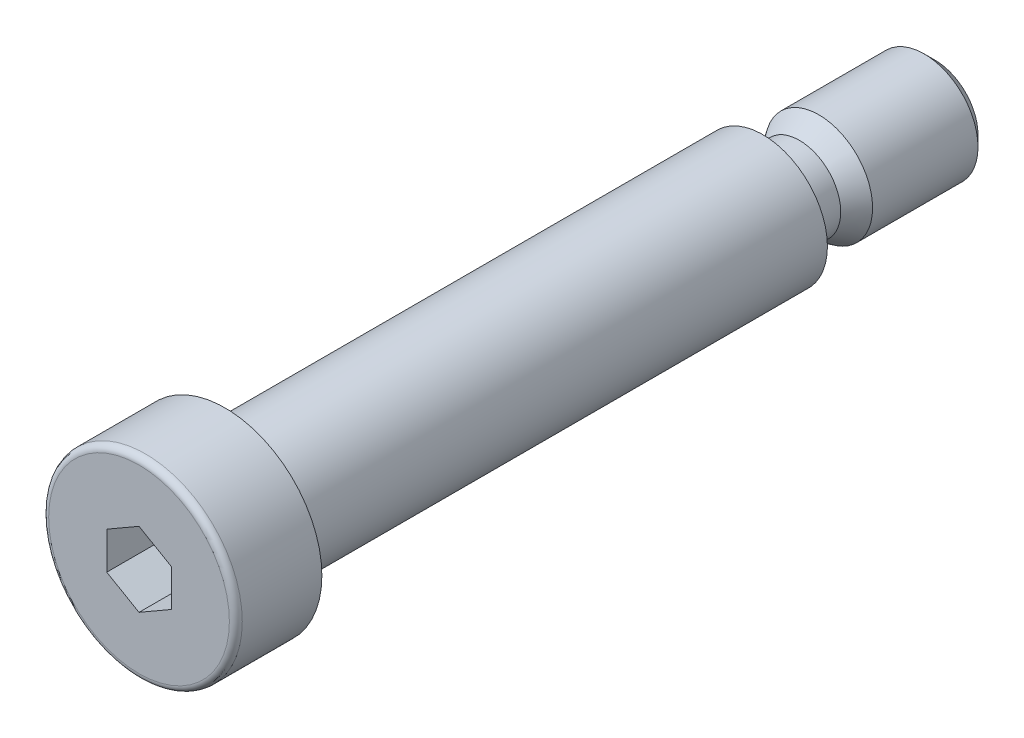
from build123d import *

# Parameters (mm, degrees)
SZKIC1_W                   = 3.85
SZKIC1_H                   = 3.39
WYTNIJ_WYCI_GNI_CIE1_DEPTH = 4.9
ZAOKR_GLENIE1_R            = 0.6


with BuildPart() as part:
    # Szkic1 → Obrót1 (revolve)
    with BuildSketch(Plane(origin=(0, 0, 0), x_dir=(1, 0, 0), z_dir=(0, 1, 0)), mode=Mode.PRIVATE) as obr_t1_sk:
        Polygon((0, -33), (0, -25), (-6, -25), (-9, -25), (-9, -33), align=None)
        Polygon((0, -25), (0, 25), (-3.85, 25), (-6, 25), (-6, -25), align=None)
        with Locations((-1.925, 26.695)):
            Rectangle(SZKIC1_W, SZKIC1_H)
        Polygon((-3.85, 28.39), (0, 28.39), (0, 41), (-4, 41), (-5, 40), (-5, 30.2), align=None)
    revolve(obr_t1_sk.sketch.rotate(Axis((0, 0, 33), (0, 0, -1)), 180), axis=Axis((0, 0, 33), (0, 0, -1)))

    # Szkic2 → Wytnij-wyciągnięcie1 (cut)
    with BuildSketch(Plane.XY.offset(33)):
        Polygon((3, 1.732050808), (0, 3.464101615), (-3, 1.732050808), (-3, -1.732050808), (0, -3.464101615), (3, -1.732050808), align=None)
    extrude(amount=-WYTNIJ_WYCI_GNI_CIE1_DEPTH, mode=Mode.SUBTRACT)

    # Zaokrąglenie1
    zaokr_glenie1_edges = [part.edges().sort_by_distance(p)[0] for p in [
        (-9, 0, 33),
    ]]
    fillet(zaokr_glenie1_edges, radius=ZAOKR_GLENIE1_R)


solid = part.part
